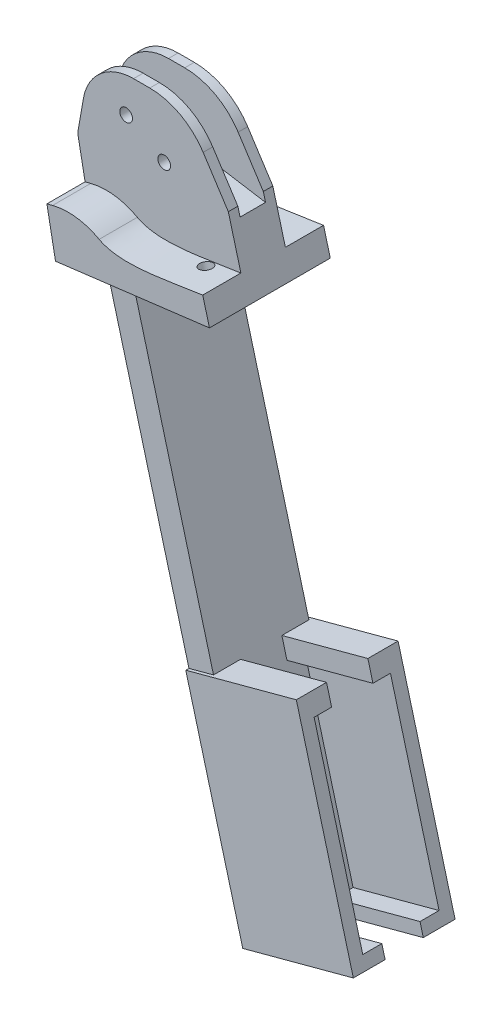
from build123d import *

# Parameters (mm, degrees)
SKETCH10_R                = 1
BOSS_EXTRUDE5_DEPTH       = 7.5
CUT_EXTRUDE1_DEPTH        = 4
FILLET1_R                 = 10
CUT_EXTRUDE6_START        = -11
CUT_EXTRUDE6_DEPTH        = 10
CUT_EXTRUDE7_DEPTH        = 2
BOSS_EXTRUDE11_DEPTH      = 9
SKETCH28_R                = 1
CUT_EXTRUDE8_DEPTH        = 9
BOSS_EXTRUDE13_DEPTH      = 80
BOSS_EXTRUDE13_DEPTH_BACK = 3
SKETCH30_W                = 4
SKETCH30_H                = 15
BOSS_EXTRUDE14_DEPTH      = 14
BOSS_EXTRUDE14_DEPTH_BACK = 4
CUT_EXTRUDE9_DEPTH        = 9
FILLET2_R                 = 8
FILLET3_R                 = 10
BOSS_EXTRUDE15_DEPTH      = 2
BOSS_EXTRUDE16_START      = 2
BOSS_EXTRUDE16_DEPTH      = 2


with BuildPart() as part:
    # Sketch10 → Boss-Extrude5 (new, symmetric)
    with BuildSketch(Plane.XY):
        Polygon((27.048887868, 48.656944563), (33.959433176, 37.989988632), (36.993816658, 26.682834617), (12.788755024, 23.658848526), (10.279677841, 36.875809012), (12.321789019, 48.656944563), align=None)
        with Locations((17.890076876, 43.12952492)):
            Circle(SKETCH10_R, mode=Mode.SUBTRACT)
        with Locations((23.882298789, 39.668364252)):
            Circle(SKETCH10_R, mode=Mode.SUBTRACT)
    extrude(amount=BOSS_EXTRUDE5_DEPTH, both=True)

    # Sketch11 → Cut-Extrude1 (cut)
    with BuildSketch(Plane.XY.offset(7.5)):
        with BuildLine():
            Line((17.825431655, 32.423947427), (9.123881611, 30.207909529))
            Line((9.123881611, 30.207909529), (6.594316119, 53.15991455))
            Line((6.594316119, 53.15991455), (34.693470887, 60.271659822))
            Line((34.693470887, 60.271659822), (37.752907488, 30.846026516))
            add(Edge.make_bspline(
                [(37.752907488, 30.846026516), (30.679137573, 30.15507536), (19.269012528, 26.734198276), (17.825431655, 32.423947427)],
                knots=[0, 0, 0, 0, 1, 1, 1, 1], degree=3))
        make_face()
    extrude(amount=-CUT_EXTRUDE1_DEPTH, mode=Mode.SUBTRACT)

    # Fillet1
    fillet1_edges = [part.edges().sort_by_distance(p)[0] for p in [
        (27.048887868, 48.656944563, -2),
    ]]
    fillet(fillet1_edges, radius=FILLET1_R)

    # Sketch11<2> → Cut-Extrude6 (cut)
    with BuildSketch(Plane.XY.offset(7.5).offset(CUT_EXTRUDE6_START)):
        with BuildLine():
            Line((17.825431655, 32.423947427), (9.123881611, 30.207909529))
            Line((9.123881611, 30.207909529), (6.594316119, 53.15991455))
            Line((6.594316119, 53.15991455), (34.693470887, 60.271659822))
            Line((34.693470887, 60.271659822), (37.752907488, 30.846026516))
            add(Edge.make_bspline(
                [(37.752907488, 30.846026516), (30.679137573, 30.15507536), (19.269012528, 26.734198276), (17.825431655, 32.423947427)],
                knots=[0, 0, 0, 0, 1, 1, 1, 1], degree=3))
        make_face()
    extrude(amount=-CUT_EXTRUDE6_DEPTH, mode=Mode.SUBTRACT)

    # Sketch16 → Cut-Extrude7 (cut, symmetric)
    with BuildSketch(Plane.XY):
        Polygon((10.074284509, 54.36084815), (34.418624568, 54.36084815), (34.418624568, 36.664364271), (10.074284509, 40.645108775), align=None)
    extrude(amount=CUT_EXTRUDE7_DEPTH, both=True, mode=Mode.SUBTRACT)

    # Sketch26 → Boss-Extrude11 (add)
    with BuildSketch(Plane(origin=(41.188168375, 11.053240949, 0), x_dir=(0, 0, -1), z_dir=(0.9658266565657433, 0.2591888683316433, 0))):
        Polygon((2, 27.88983665), (2, 26.535626274), (-2, 26.535626274), (-2, 27.88983665), (-3.5, 27.88983665), (-3.5, 20.267140373), (-7.5, 20.267140373), (-7.5, 16.182607471), (7.5, 16.182607471), (7.5, 20.267140372), (3.5, 20.267140373), (3.5, 27.88983665), align=None)
    extrude(amount=BOSS_EXTRUDE11_DEPTH)

    # Sketch28 → Cut-Extrude8 (cut)
    with BuildSketch(Plane(origin=(-4.194351717, 15.629593668, 0), x_dir=(0.9658266565657433, 0.25918886833164334, 0), z_dir=(0.25918886833164334, -0.9658266565657433, 0))):
        with Locations((38.244135106, 4.615132599)):
            Circle(SKETCH28_R)
        with Locations((38.244135106, -4.615132599)):
            Circle(SKETCH28_R)
    extrude(amount=-CUT_EXTRUDE8_DEPTH, mode=Mode.SUBTRACT)

    # Sketch30 → Boss-Extrude13 (add, two sides: drawn at the far end of the back side and taken through both)
    with BuildSketch(Plane(origin=(-4.194351717, 15.629593668, 0), x_dir=(0.9658266565657433, 0.25918886833164334, 0), z_dir=(0.25918886833164334, -0.9658266565657433, 0)).offset(-BOSS_EXTRUDE13_DEPTH_BACK)):
        with Locations((26.645507965, 0)):
            Rectangle(SKETCH30_W, SKETCH30_H)
    extrude(amount=BOSS_EXTRUDE13_DEPTH + BOSS_EXTRUDE13_DEPTH_BACK)

    # Sketch31 → Boss-Extrude14 (add, two sides: drawn at the far end of the back side and taken through both)
    with BuildSketch(Plane(origin=(27.666595183, 7.424596792, 0), x_dir=(0, 0, -1), z_dir=(0.9658266565657432, 0.2591888683316434, 0)).offset(-BOSS_EXTRUDE14_DEPTH_BACK)):
        Polygon((-3.25, -30.731166129), (-8, -30.731166129), (-8, -65.317392529), (-3, -65.317392529), (-3, -63.317392529), (-6, -63.317392529), (-6, -33.817392529), (-3.25, -33.817392529), align=None)
        Polygon((3, -63.317392529), (3, -65.317392529), (8, -65.317392529), (8, -30.731166129), (3.25, -30.731166129), (3.25, -33.817392529), (6, -33.817392529), (6, -63.317392529), align=None)
    extrude(amount=BOSS_EXTRUDE14_DEPTH + BOSS_EXTRUDE14_DEPTH_BACK)

    # Sketch32 → Cut-Extrude9 (cut)
    with BuildSketch(Plane(origin=(49.880608284, 13.385940764, 0), x_dir=(0, 0, -1), z_dir=(0.9658266565657431, 0.25918886833164445, 0))):
        Polygon((3.5, 27.88983665), (2, 27.88983665), (2, 26.535626274), (-2, 26.535626274), (-2, 27.88983665), (-3.5, 27.88983665), (-3.5, 20.267140373), (-7.5, 20.267140373), (-7.5, 16.182607471), (7.5, 16.182607471), (7.5, 20.267140372), (3.5, 20.267140373), align=None)
    extrude(amount=-CUT_EXTRUDE9_DEPTH, mode=Mode.SUBTRACT)

    # Fillet2
    fillet2_edges = [part.edges().sort_by_distance(p)[0] for p in [
        (12.321789019, 48.656944563, 2.75),
        (12.321789019, 48.656944563, -2.75),
    ]]
    fillet(fillet2_edges, radius=FILLET2_R)

    # Fillet3
    fillet3_edges = [part.edges().sort_by_distance(p)[0] for p in [
        (17.825431655, 32.423947427, 5.5),
        (17.825431655, 32.423947427, -5.5),
    ]]
    fillet(fillet3_edges, radius=FILLET3_R)

    # Sketch33 → Boss-Extrude15 (add)
    with BuildSketch(Plane(origin=(0, 0, -7.5), x_dir=(-1, 0, 0), z_dir=(0, 0, -1))):
        with BuildLine():
            Line((-11.433819556, 30.796185182), (-12.326379112, 31.023494775))
            ThreePointArc((-12.326379112, 31.023494775), (-16.080268918, 31.249787506), (-19.652288318, 30.073533078))
            add(Edge.make_bspline(
                [(-19.652288318, 30.073533078), (-23.094178016, 28.160579122), (-30.349802092, 29.858629099), (-35.935151197, 30.627785373)],
                knots=[0.191604014, 0.191604014, 0.191604014, 0.191604014, 0.918085752, 0.918085752, 0.918085752, 0.918085752], degree=3))
            Line((-35.935151197, 30.627785373), (-36.993816658, 26.682834617))
            Line((-36.993816658, 26.682834617), (-22.968678464, 24.93064644))
            Line((-22.968678464, 24.93064644), (-12.788755024, 23.658848526))
            Line((-12.788755024, 23.658848526), (-11.433819556, 30.796185182))
        make_face()
    extrude(amount=BOSS_EXTRUDE15_DEPTH)

    # Sketch34 → Boss-Extrude16 (add)
    with BuildSketch(Plane.XY.offset(7.5).offset(BOSS_EXTRUDE16_START)):
        with BuildLine():
            Line((12.326379112, 31.023494775), (11.433819556, 30.796185182))
            Line((11.433819556, 30.796185182), (12.788755024, 23.658848526))
            Line((12.788755024, 23.658848526), (22.968678464, 24.93064644))
            Line((22.968678464, 24.93064644), (36.993816658, 26.682834617))
            Line((36.993816658, 26.682834617), (35.935151197, 30.627785373))
            add(Edge.make_bspline(
                [(35.935151197, 30.627785373), (30.349802091, 29.858629099), (23.094178016, 28.160579122), (19.652288318, 30.073533078)],
                knots=[0.191604014, 0.191604014, 0.191604014, 0.191604014, 0.918085752, 0.918085752, 0.918085752, 0.918085752], degree=3))
            ThreePointArc((19.652288318, 30.073533078), (16.080268918, 31.249787506), (12.326379112, 31.023494775))
        make_face()
    extrude(amount=-BOSS_EXTRUDE16_DEPTH)


solid = part.part
